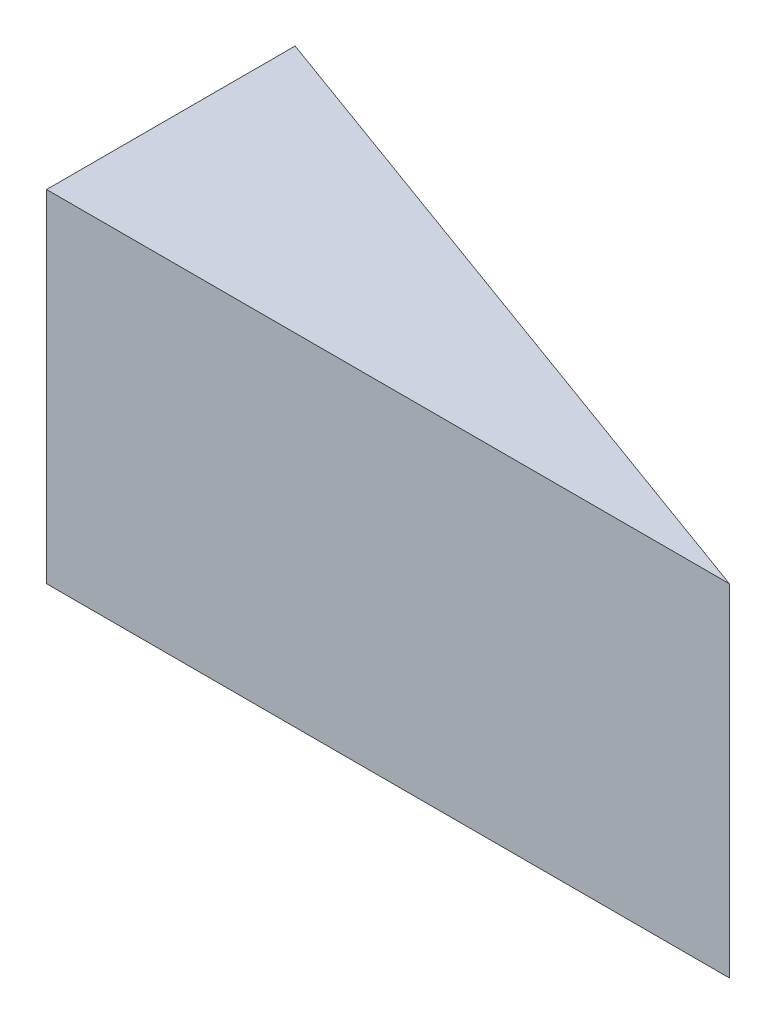
from build123d import *

# Parameters (mm, degrees)
BOSS_EXTRUDE1_DEPTH = 20


with BuildPart() as part:
    # Sketch1 → Boss-Extrude1 (new body)
    with BuildSketch(Plane(origin=(0, 0, 0), x_dir=(1, 0, 0), z_dir=(0, 1, 0))):
        Polygon((0, 0), (40, 0), (0, 14.558809371), align=None)
    extrude(amount=BOSS_EXTRUDE1_DEPTH)


solid = part.part
